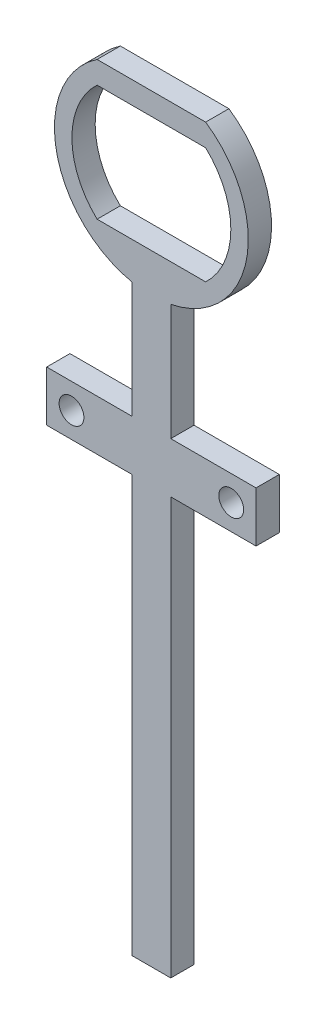
from build123d import *

# Parameters (mm, degrees)
BOSS_EXTRUDE1_DEPTH = 3
SKETCH3_W           = 27
SKETCH3_H           = 6.5
SKETCH3_R           = 1.6
BOSS_EXTRUDE2_DEPTH = 3


with BuildPart() as part:
    # Sketch1 → Boss-Extrude1 (new body)
    with BuildSketch(Plane.XY):
        with BuildLine():
            Line((2.5, -87.48740775), (2.5, -12.247448714))
            ThreePointArc((2.5, -12.247448714), (12.259414932, -2.440644491), (7, 10.356157589))
            Line((7, 10.356157589), (-7, 10.356157589))
            ThreePointArc((-7, 10.356157589), (-12.259414932, -2.440644491), (-2.5, -12.247448714))
            Line((-2.5, -12.247448714), (-2.5, -87.48740775))
            Line((-2.5, -87.48740775), (2.5, -87.48740775))
        make_face()
        with BuildLine():
            ThreePointArc((7, -7.487489566), (10.25, 0), (7, 7.487489566))
            Line((7, 7.487489566), (-7, 7.487489566))
            ThreePointArc((-7, 7.487489566), (-10.25, 0), (-7, -7.487489566))
            Line((-7, -7.487489566), (7, -7.487489566))
        make_face(mode=Mode.SUBTRACT)
    extrude(amount=BOSS_EXTRUDE1_DEPTH)

    # Sketch3 → Boss-Extrude2 (add)
    with BuildSketch(Plane.XY):
        with Locations((0, -30.497448714)):
            Rectangle(SKETCH3_W, SKETCH3_H)
        with Locations((-10.3, -30.497448714)):
            Circle(SKETCH3_R, mode=Mode.SUBTRACT)
        with Locations(Location((10.3, -30.497448714, 0), (0, 0, 180))):
            Circle(SKETCH3_R, mode=Mode.SUBTRACT)
    extrude(amount=BOSS_EXTRUDE2_DEPTH)


solid = part.part
